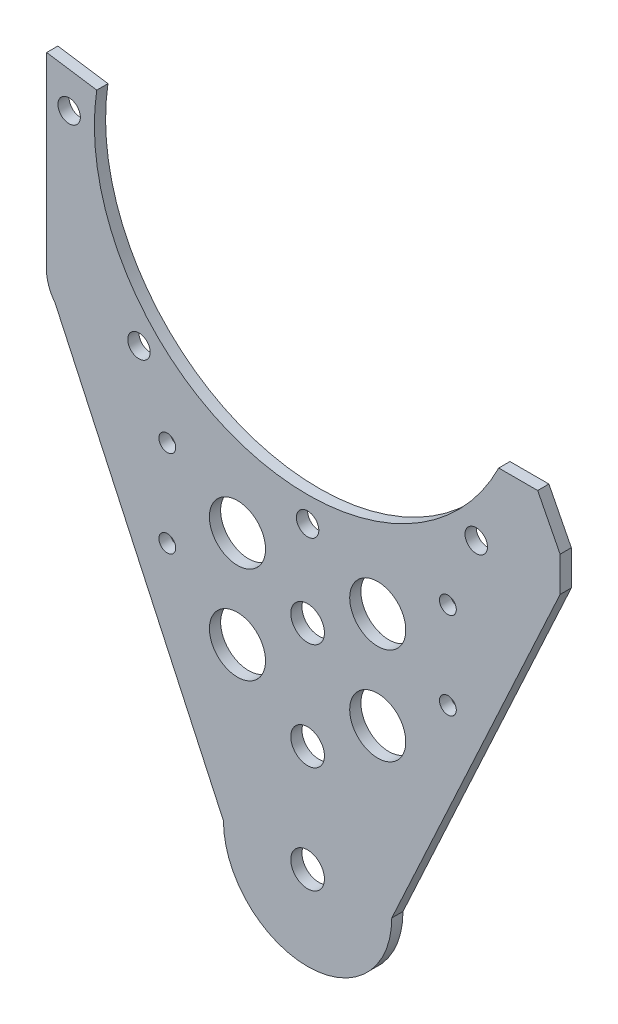
from build123d import *

# Parameters (mm, degrees)
SKETCH_3_R      = 3
SKETCH_3_R_2    = 2
SKETCH_3_R_3    = 1.5
SKETCH_3_R_4    = 5
EXTRUDE_1_DEPTH = 2


with BuildPart() as part:
    # 草图3 → 凸台-拉伸1 (new body)
    with BuildSketch(Plane.XY):
        with BuildLine():
            Line((-46.5, 63), (-37.576612526, 61.656694359))
            ThreePointArc((-37.576612526, 61.656694359), (-11.38853896, 19.746708007), (34.06116735, 39.152540881))
            Line((34.06116735, 39.152540881), (41, 39.152540881))
            Line((41, 39.152540881), (45, 31.317051182))
            Line((45, 31.317051182), (45, 25.109783315))
            Line((45, 25.109783315), (15, -39.82))
            ThreePointArc((15, -39.82), (0, -54.82), (-15, -39.82))
            Line((-15, -39.82), (-45, 25.109783315))
            add(Edge.make_bspline(
                [(-45, 25.109783315), (-46.274240542, 26.725120767), (-46.5, 28.773494756)],
                knots=[0, 0, 0, 1, 1, 1], degree=2))
            Line((-46.5, 28.773494756), (-46.5, 63))
        make_face()
        with Locations((0, -1.82)):
            Circle(SKETCH_3_R, mode=Mode.SUBTRACT)
        with Locations((0, 13.5)):
            Circle(SKETCH_3_R_2, mode=Mode.SUBTRACT)
        with Locations((-30.0520382, 25.9479618)):
            Circle(SKETCH_3_R_2, mode=Mode.SUBTRACT)
        with Locations((-42.5, 56)):
            Circle(SKETCH_3_R_2, mode=Mode.SUBTRACT)
        with Locations((30.0520382, 25.9479618)):
            Circle(SKETCH_3_R_2, mode=Mode.SUBTRACT)
        with Locations((0, -20.82)):
            Circle(SKETCH_3_R, mode=Mode.SUBTRACT)
        with Locations((0, -39.82)):
            Circle(SKETCH_3_R, mode=Mode.SUBTRACT)
        with Locations((-25, -1.990216685)):
            Circle(SKETCH_3_R_3, mode=Mode.SUBTRACT)
        with Locations((-25, 13.509783315)):
            Circle(SKETCH_3_R_3, mode=Mode.SUBTRACT)
        with Locations(Location((25, 13.509783315, 0), (0, 0, 180))):
            Circle(SKETCH_3_R_3, mode=Mode.SUBTRACT)
        with Locations(Location((25, -1.990216685, 0), (0, 0, 180))):
            Circle(SKETCH_3_R_3, mode=Mode.SUBTRACT)
        with Locations((-12.5, -11.405108343)):
            Circle(SKETCH_3_R_4, mode=Mode.SUBTRACT)
        with Locations((-12.5, 5.844891657)):
            Circle(SKETCH_3_R_4, mode=Mode.SUBTRACT)
        with Locations(Location((12.5, 5.844891657, 0), (0, 0, 180))):
            Circle(SKETCH_3_R_4, mode=Mode.SUBTRACT)
        with Locations(Location((12.5, -11.405108343, 0), (0, 0, 180))):
            Circle(SKETCH_3_R_4, mode=Mode.SUBTRACT)
    extrude(amount=EXTRUDE_1_DEPTH)


solid = part.part
